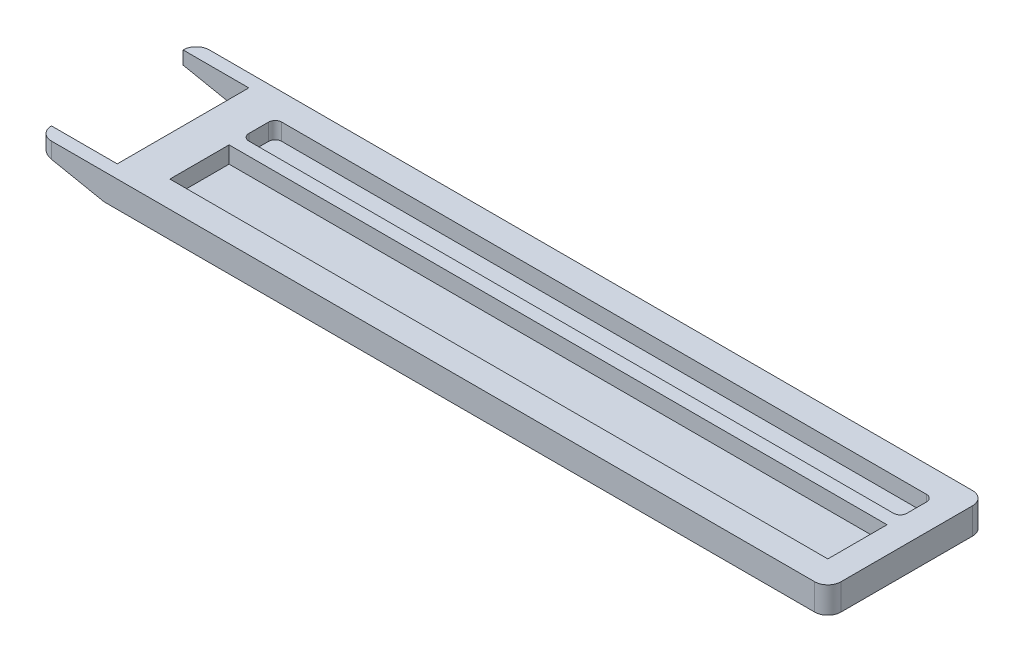
from build123d import *

# Parameters (mm, degrees)
SKETCH1_W           = 600
SKETCH1_H           = 120
BOSS_EXTRUDE1_DEPTH = 20
CUT_EXTRUDE1_REACH  = 325.728
SKETCH6_W           = 500
SKETCH6_H           = 25
SKETCH6_H_2         = 45
CUT_EXTRUDE2_DEPTH  = 12.7
FILLET1_R           = 10
FILLET2_R           = 5
CUT_EXTRUDE3_REACH  = 308.594
SKETCH7_W           = 50
SKETCH7_H           = 100


with BuildPart() as part:
    # Sketch1 → Boss-Extrude1 (new body)
    with BuildSketch(Plane(origin=(0, 0, 0), x_dir=(1, 0, 0), z_dir=(0, 1, 0))):
        Rectangle(SKETCH1_W, SKETCH1_H)
    extrude(amount=BOSS_EXTRUDE1_DEPTH)

    # Sketch4 → Cut-Extrude1 (cut, up to next)
    with BuildSketch(Plane.XY.offset(60), mode=Mode.PRIVATE) as cut_extrude1_sk1:
        Polygon((-300, 10), (-250, 0), (-300, 0), align=None)
    cut_extrude1_tool1 = extrude(cut_extrude1_sk1.sketch, amount=-CUT_EXTRUDE1_REACH, mode=Mode.PRIVATE) & part.part
    add(cut_extrude1_tool1.solids().sort_by_distance((-283.333333, 3.333333, 60))[0], mode=Mode.SUBTRACT)

    # Sketch6 → Cut-Extrude2 (cut)
    with BuildSketch(Plane(origin=(0, 20, 0), x_dir=(1, 0, 0), z_dir=(0, 1, 0))):
        with Locations((30, 27.5)):
            Rectangle(SKETCH6_W, SKETCH6_H)
        with Locations((30, -17.5)):
            Rectangle(SKETCH6_W, SKETCH6_H_2)
    extrude(amount=-CUT_EXTRUDE2_DEPTH, mode=Mode.SUBTRACT)

    # Fillet1
    fillet1_edges = [part.edges().sort_by_distance(p)[0] for p in [
        (-300, 15, -60),
        (300, 10, -60),
        (300, 10, 60),
        (-300, 15, 60),
    ]]
    fillet(fillet1_edges, radius=FILLET1_R)

    # Fillet2
    fillet2_edges = [part.edges().sort_by_distance(p)[0] for p in [
        (-220, 13.65, -15),
        (-220, 13.65, -40),
        (280, 13.65, -40),
        (280, 13.65, -15),
    ]]
    fillet(fillet2_edges, radius=FILLET2_R)

    # Sketch7 → Cut-Extrude3 (cut, up to next)
    with BuildSketch(Plane(origin=(0, 20, 0), x_dir=(1, 0, 0), z_dir=(0, 1, 0)), mode=Mode.PRIVATE) as cut_extrude3_sk1:
        with Locations((-275, 0)):
            Rectangle(SKETCH7_W, SKETCH7_H)
    cut_extrude3_tool1 = extrude(cut_extrude3_sk1.sketch, amount=-CUT_EXTRUDE3_REACH, mode=Mode.PRIVATE) & part.part
    add(cut_extrude3_tool1.solids().sort_by_distance((-275, 20, 0))[0], mode=Mode.SUBTRACT)


solid = part.part
